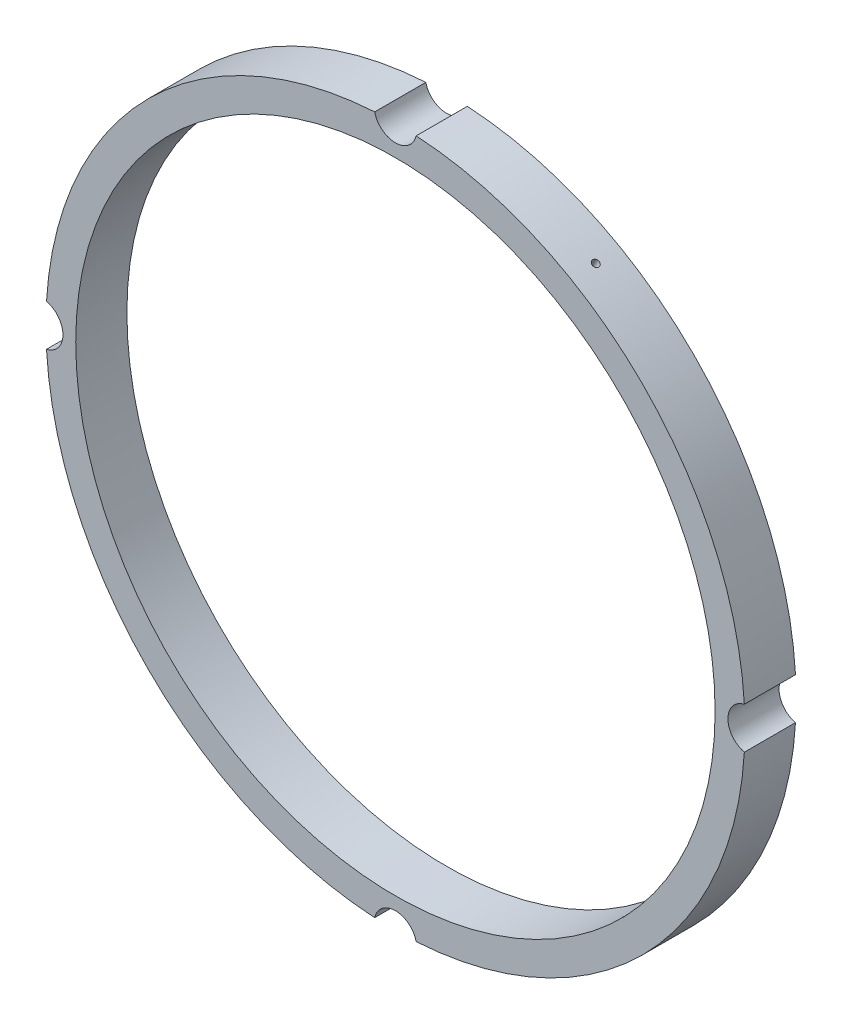
from build123d import *

# Parameters (mm, degrees)
SKETCH1_R                 = 82
SKETCH1_R_2               = 75
BOSS_EXTRUDE1_DEPTH       = 12
SKETCH2_R                 = 5
CUT_EXTRUDE1_DEPTH        = 117.584733134
CIRPATTERN1_COUNT         = 4
M2X0_4_TAPPED_HOLE1_D     = 1.6
M2X0_4_TAPPED_HOLE1_DEPTH = 10
M2X0_4_TAPPED_HOLE1_TIP   = 0.480688495


with BuildPart() as part:
    # Sketch1 → Boss-Extrude1 (new body)
    with BuildSketch(Plane.XY):
        Circle(SKETCH1_R)
        Circle(SKETCH1_R_2, mode=Mode.SUBTRACT)
    extrude(amount=BOSS_EXTRUDE1_DEPTH)

    # Sketch2 → Cut-Extrude1 (cut, through all)
    with BuildSketch(Plane.XY.offset(12)):
        with Locations((0, 83)):
            Circle(SKETCH2_R)
    cut_extrude1 = extrude(amount=-CUT_EXTRUDE1_DEPTH, mode=Mode.SUBTRACT)

    # CirPattern1: Cut-Extrude1 ×4 about axis
    cirpattern1_axis = Axis((0, 0, 0), (0, 0, 1))
    for i in range(1, CIRPATTERN1_COUNT):
        add(cut_extrude1.rotate(cirpattern1_axis, i * 360 / CIRPATTERN1_COUNT), mode=Mode.SUBTRACT)

    # M2x0.4 Tapped Hole1
    with Locations(Plane(origin=(41, 71.01408311, 6), x_dir=(0.866025403784, -0.5, 0), z_dir=(0.5, 0.866025403784, 0))):
        with Locations((0, 0)):
            Hole(M2X0_4_TAPPED_HOLE1_D / 2, depth=M2X0_4_TAPPED_HOLE1_DEPTH)
            with Locations((0, 0, -(M2X0_4_TAPPED_HOLE1_DEPTH + M2X0_4_TAPPED_HOLE1_TIP / 2))):  # 118° drill point
                Cone(0, M2X0_4_TAPPED_HOLE1_D / 2, M2X0_4_TAPPED_HOLE1_TIP, mode=Mode.SUBTRACT)


solid = part.part
